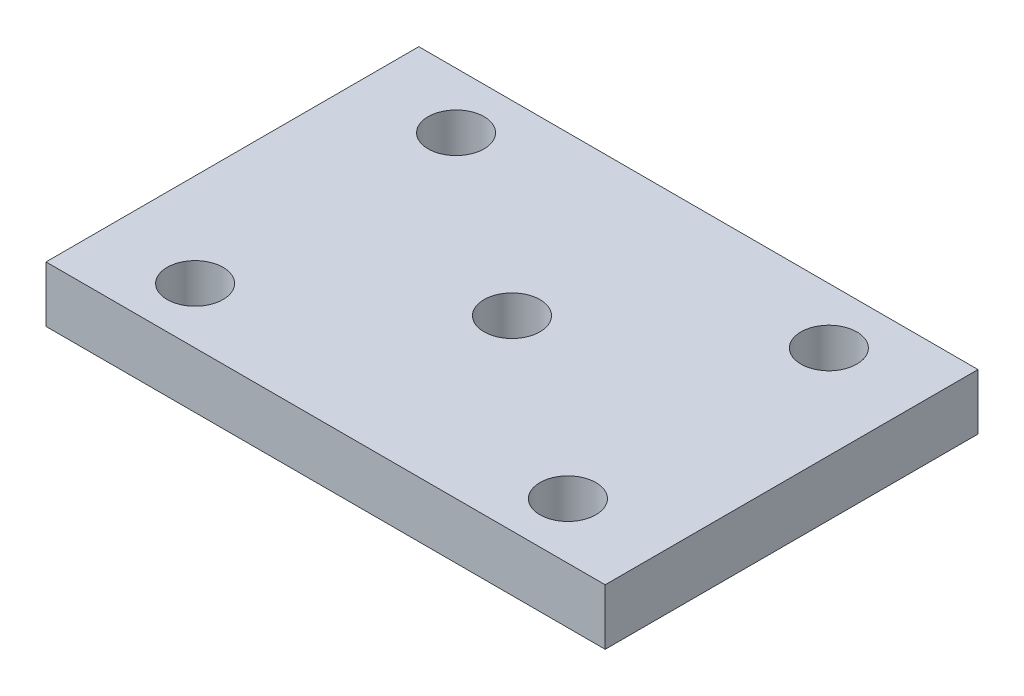
from build123d import *

# Parameters (mm, degrees)
SKETCH_1_W      = 30
SKETCH_1_H      = 20
SKETCH_1_R      = 1.5
EXTRUDE_1_DEPTH = 3


with BuildPart() as part:
    # 草图1 → 凸台-拉伸1 (new body)
    with BuildSketch(Plane(origin=(0, 0, 0), x_dir=(1, 0, 0), z_dir=(0, 1, 0))):
        Rectangle(SKETCH_1_W, SKETCH_1_H)
        with Locations(Location((-10, -7, 0), (0, 0, 270))):
            Circle(SKETCH_1_R, mode=Mode.SUBTRACT)
        with Locations(Location((10, -7, 0), (0, 0, 90))):
            Circle(SKETCH_1_R, mode=Mode.SUBTRACT)
        with Locations(Location((10, 7, 0), (0, 0, 270))):
            Circle(SKETCH_1_R, mode=Mode.SUBTRACT)
        with Locations(Location((-10, 7, 0), (0, 0, 90))):
            Circle(SKETCH_1_R, mode=Mode.SUBTRACT)
        with Locations(Location((0, 0, 0), (0, 0, 270))):
            Circle(SKETCH_1_R, mode=Mode.SUBTRACT)
    extrude(amount=EXTRUDE_1_DEPTH)


solid = part.part
